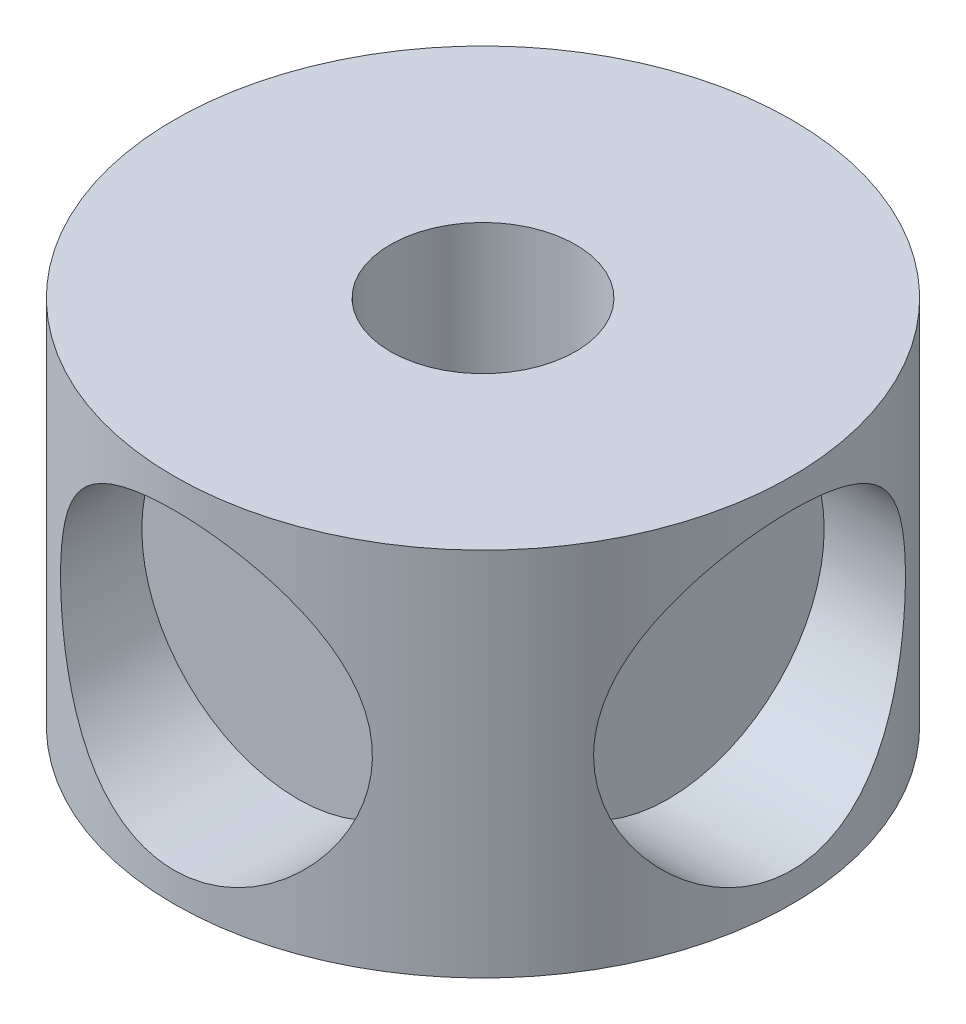
from build123d import *

# Parameters (mm, degrees)
SKETCH_1_R               = 10
SKETCH_1_R_2             = 3
EXTRUDE_1_DEPTH          = 12
CUT_EXTRUDE_START        = 6
SKETCH_2_R               = 5.05
CUT_EXTRUDE_1_DEPTH      = 12
PATTERN_CIRCULAR_1_COUNT = 4


with BuildPart() as part:
    # 草图1 → 凸台-拉伸1 (new body)
    with BuildSketch(Plane(origin=(0, 0, 0), x_dir=(1, 0, 0), z_dir=(0, 1, 0))):
        with Locations(Location((0, 0, 0), (0, 0, 270))):
            Circle(SKETCH_1_R)
        with Locations(Location((0, 0, 0), (0, 0, 270))):
            Circle(SKETCH_1_R_2, mode=Mode.SUBTRACT)
    extrude(amount=EXTRUDE_1_DEPTH)

    # 草图2 → 切除-拉伸1 (cut)
    with BuildSketch(Plane.XY.offset(CUT_EXTRUDE_START)):
        with Locations(Location((0, 6, 0), (0, 0, 180))):
            Circle(SKETCH_2_R)
    cut_extrude_1 = extrude(amount=CUT_EXTRUDE_1_DEPTH, mode=Mode.SUBTRACT)

    # 阵列(圆周)1: 切除-拉伸1 ×4 about axis
    pattern_circular_1_axis = Axis((0, 0, 0), (0, 1, 0))
    for i in range(1, PATTERN_CIRCULAR_1_COUNT):
        add(cut_extrude_1.rotate(pattern_circular_1_axis, i * 360 / PATTERN_CIRCULAR_1_COUNT), mode=Mode.SUBTRACT)


solid = part.part
